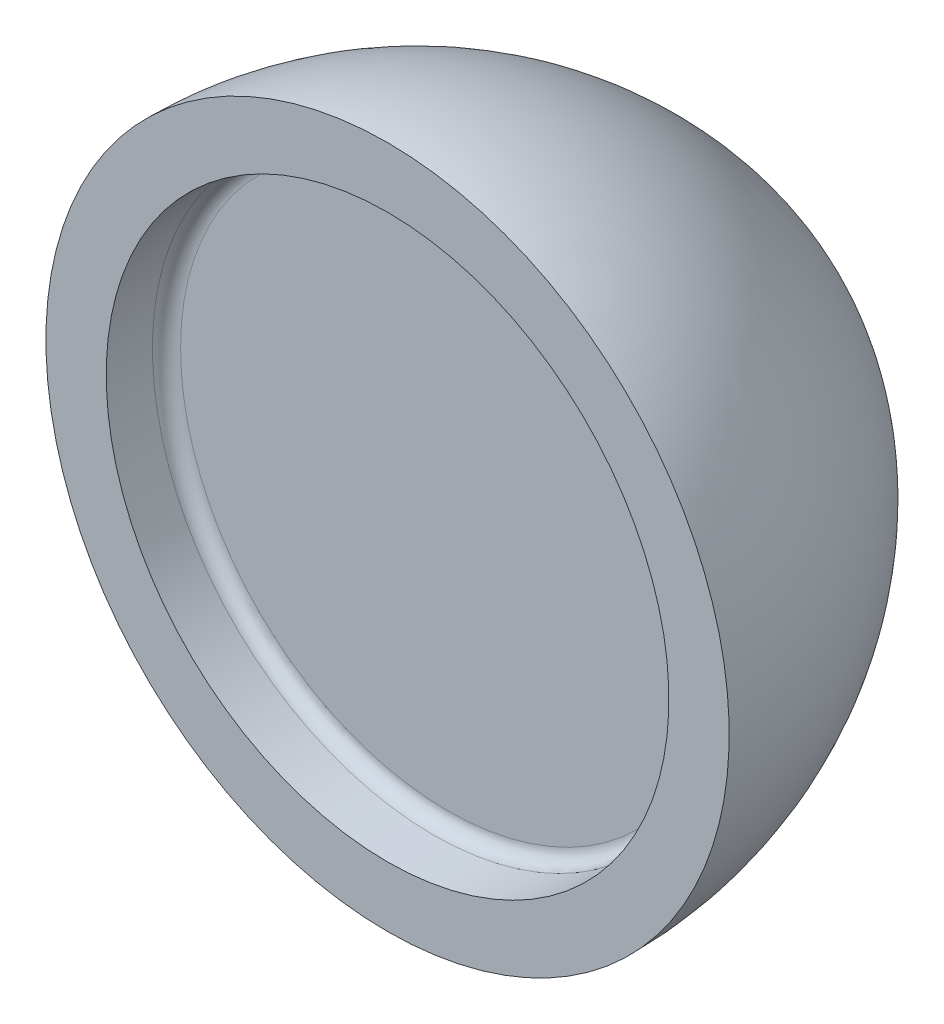
from build123d import *

# Parameters (mm, degrees)
FILLET1_R = 0.7


with BuildPart() as part:
    # Sketch1 → Revolve1 (revolve)
    with BuildSketch(Plane(origin=(0, 0, 0), x_dir=(0, 0, -1), z_dir=(1, 0, 0)), mode=Mode.PRIVATE) as revolve1_sk:
        with BuildLine():
            Line((3, 14), (3, 0))
            Line((3, 0), (20, 0))
            ThreePointArc((20, 0), (13.124404748, 12.175770292), (0, 17))
            Line((0, 17), (0, 14))
            Line((0, 14), (3, 14))
        make_face()
    revolve(revolve1_sk.sketch.rotate(Axis((0, 0, -3), (0, 0, -1)), 180), axis=Axis((0, 0, -3), (0, 0, -1)))

    # Fillet1
    fillet1_edges = [part.edges().sort_by_distance(p)[0] for p in [
        (0, 14, -3),
    ]]
    fillet(fillet1_edges, radius=FILLET1_R)


solid = part.part
